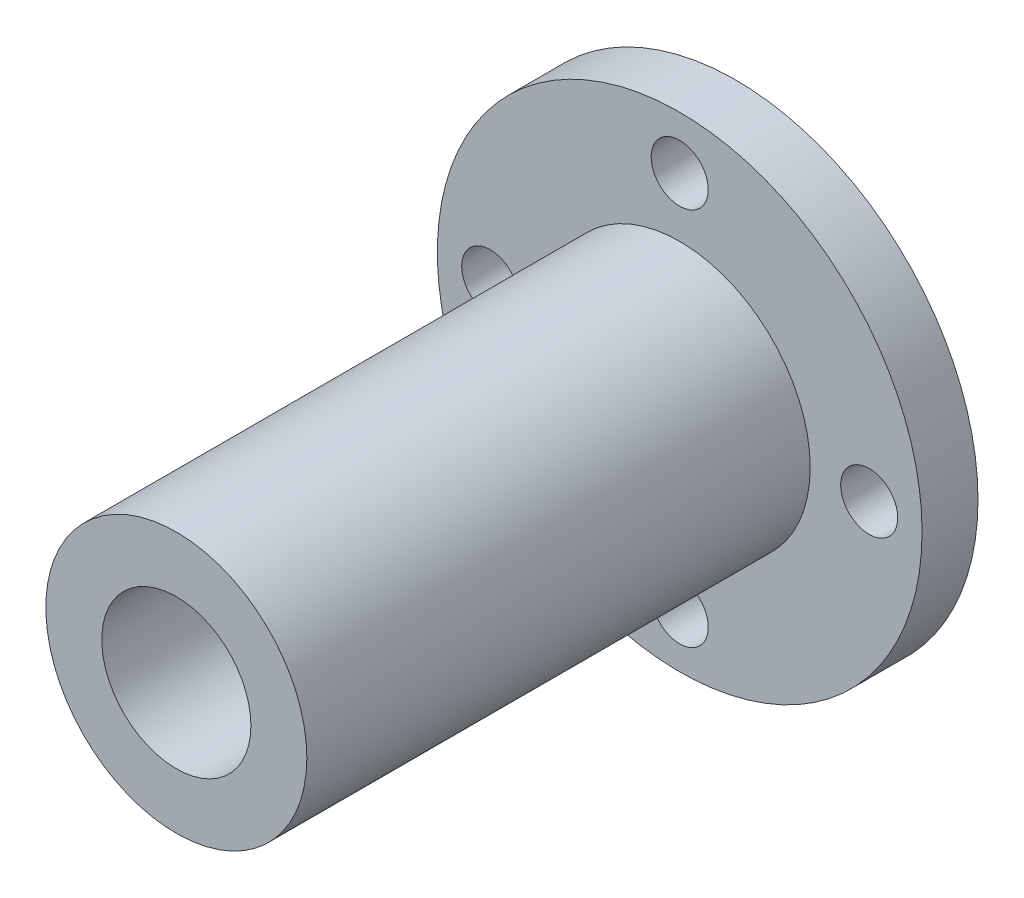
from build123d import *

# Parameters (mm, degrees)
CROQUIS2_R            = 1.530907885
CORTAR_EXTRUIR1_DEPTH = 10


with BuildPart() as part:
    # Croquis1 → Revolución1 (revolve)
    with BuildSketch(Plane(origin=(0, 0, 0), x_dir=(0, 0, -1), z_dir=(1, 0, 0)), mode=Mode.PRIVATE) as revoluci_n1_sk:
        Polygon((0, 0), (0, 9), (-3, 9), (-3, 3), (-30, 3), (-30, 0), align=None)
    revolve(revoluci_n1_sk.sketch.rotate(Axis((0, -4, 49.046153846), (0, 0, -1)), 90), axis=Axis((0, -4, 49.046153846), (0, 0, -1)))

    # Croquis2 → Cortar-Extruir1 (cut)
    with BuildSketch(Plane(origin=(0, 0, 0), x_dir=(-1, 0, 0), z_dir=(0, 0, -1))):
        with Locations((0, 6.163841236)):
            Circle(CROQUIS2_R)
        with Locations((10.163841236, -4)):
            Circle(CROQUIS2_R)
        with Locations((0, -14.163841236)):
            Circle(CROQUIS2_R)
        with Locations((-10.163841236, -4)):
            Circle(CROQUIS2_R)
    extrude(amount=-CORTAR_EXTRUIR1_DEPTH, mode=Mode.SUBTRACT)


solid = part.part
